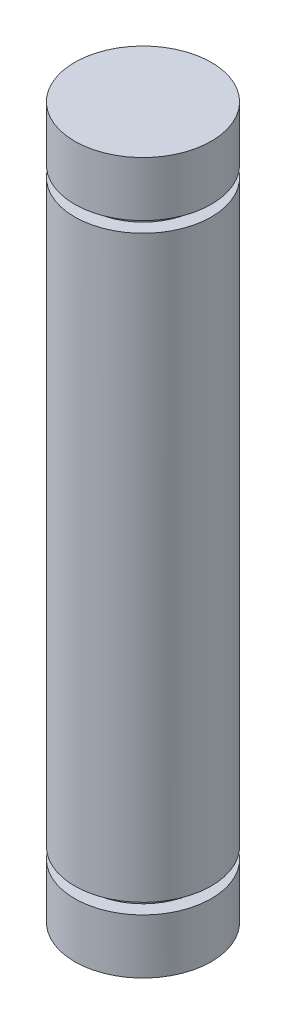
from build123d import *

# Parameters (mm, degrees)
SKETCH1_R           = 1.5875
BOSS_EXTRUDE1_DEPTH = 16.51
SKETCH3_R           = 1.903344521
SKETCH3_R_2         = 1.27
CUT_EXTRUDE2_DEPTH  = 0.254


with BuildPart() as part:
    # Sketch1 → Boss-Extrude1 (new body)
    with BuildSketch(Plane(origin=(0, 0, 0), x_dir=(1, 0, 0), z_dir=(0, 1, 0))):
        Circle(SKETCH1_R)
    extrude(amount=BOSS_EXTRUDE1_DEPTH)

    # Sketch3 → Cut-Extrude2 (cut)
    with BuildSketch(Plane(origin=(0, 1.27, 0), x_dir=(-1, 0, 0), z_dir=(0, -1, 0))):
        Circle(SKETCH3_R)
        Circle(SKETCH3_R_2, mode=Mode.SUBTRACT)
    cut_extrude2 = extrude(amount=-CUT_EXTRUDE2_DEPTH, mode=Mode.SUBTRACT)

    # Mirror2: Cut-Extrude2 across plane
    add(cut_extrude2.mirror(Plane(origin=(0, 8.255, 0), x_dir=(0, 0, 1), z_dir=(0, -1, 0))), mode=Mode.SUBTRACT)


solid = part.part
